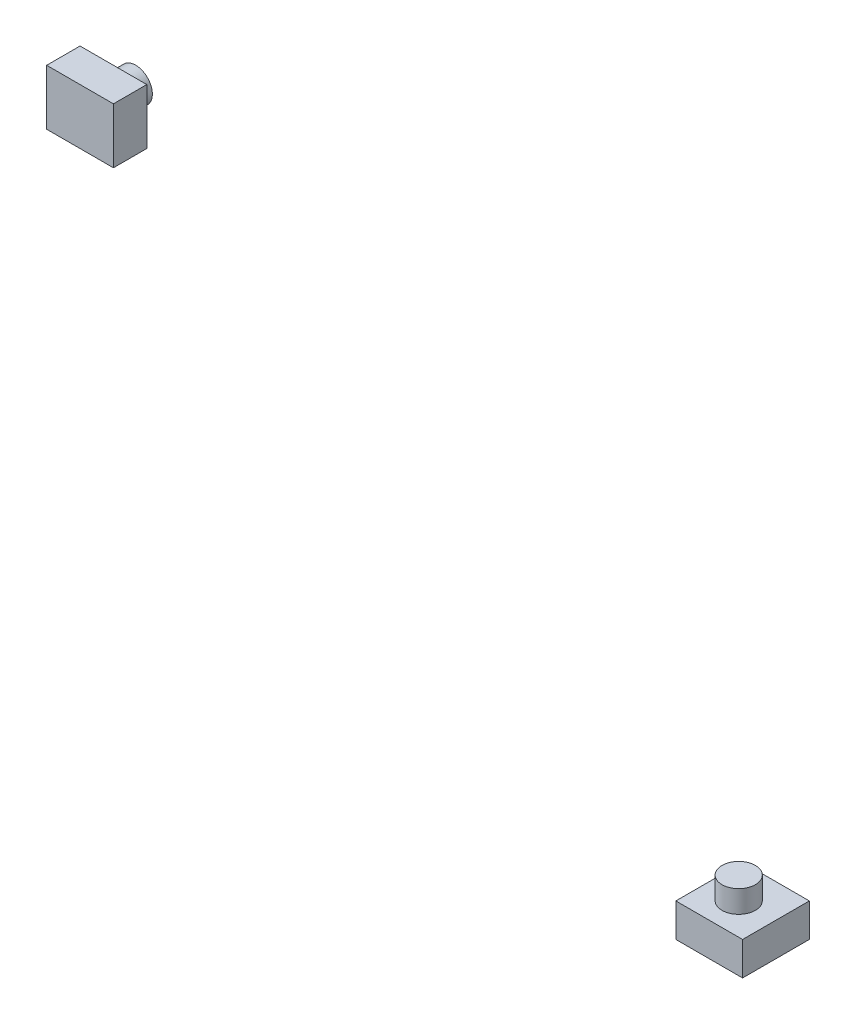
from build123d import *

# Parameters (mm, degrees)
SKETCH1_R      = 9.525
EXTRUDE1_DEPTH = 12.7
SKETCH2_W      = 38.1
SKETCH2_H      = 38.1
EXTRUDE2_DEPTH = 19.05
SKETCH3_R      = 9.525
EXTRUDE3_DEPTH = 12.7
SKETCH4_W      = 38.1
SKETCH4_H      = 31.634756462
EXTRUDE4_DEPTH = 19.05


with BuildPart() as part:
    # Sketch1 → Extrude1 (new body)
    with BuildSketch(Plane(origin=(0, 0, 0), x_dir=(1, 0, 0), z_dir=(0, 1, 0))):
        with Locations(Location((0, 0, 0), (0, 0, 270))):
            Circle(SKETCH1_R)
    extrude(amount=-EXTRUDE1_DEPTH)

    # Sketch2 → Extrude2 (add)
    with BuildSketch(Plane.XZ.offset(12.7)):
        with Locations((1.191835115, -1.018196851)):
            Rectangle(SKETCH2_W, SKETCH2_H)
    extrude(amount=EXTRUDE2_DEPTH)


with BuildPart() as body_2:
    # Sketch3 → Extrude3 (new body)
    with BuildSketch(Plane.XY.offset(-189.23)):
        with Locations((-533.4, 29.464)):
            Circle(SKETCH3_R)
    extrude(amount=EXTRUDE3_DEPTH)

    # Sketch4 → Extrude4 (add)
    with BuildSketch(Plane.XY.offset(-176.53)):
        with Locations((-533.4, 29.464)):
            Rectangle(SKETCH4_W, SKETCH4_H)
    extrude(amount=EXTRUDE4_DEPTH)


solid = Compound([part.part, body_2.part])
